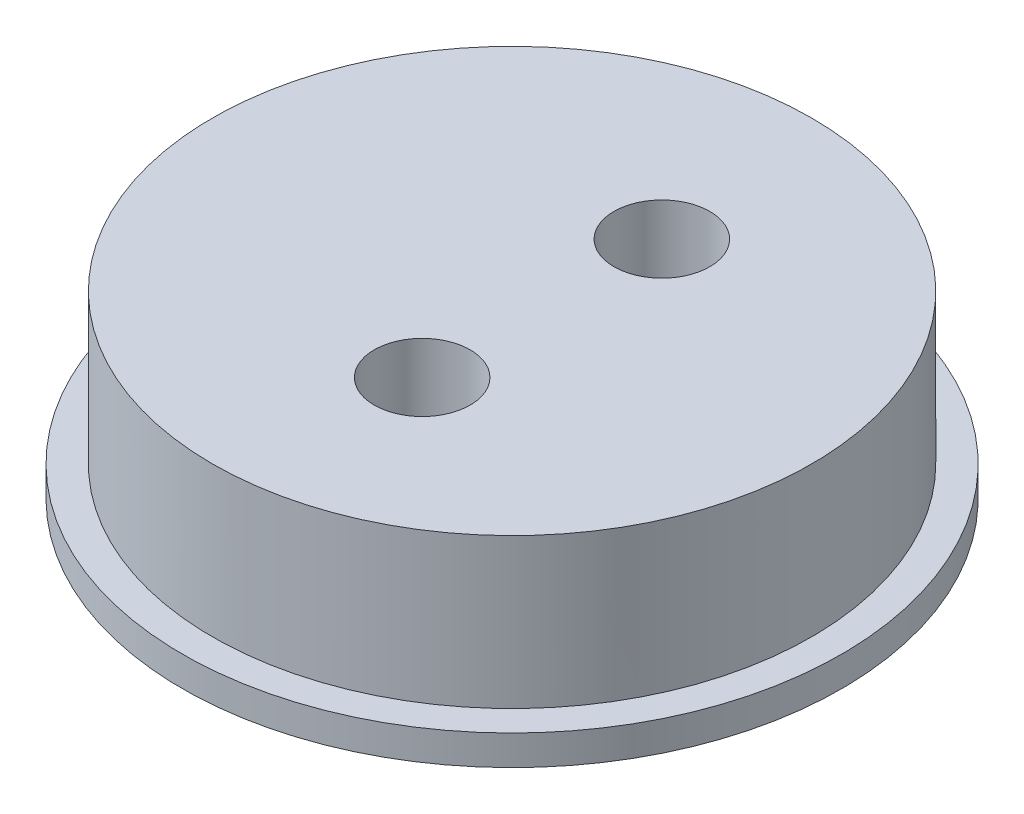
from build123d import *

# Parameters (mm, degrees)
SKETCH1_R           = 10
BOSS_EXTRUDE1_DEPTH = 6
SKETCH2_R           = 11
BOSS_EXTRUDE2_DEPTH = 1
SKETCH4_R           = 1.6
CUT_EXTRUDE1_DEPTH  = 18.349351573


with BuildPart() as part:
    # Sketch1 → Boss-Extrude1 (new body)
    with BuildSketch(Plane(origin=(0, 0, 0), x_dir=(1, 0, 0), z_dir=(0, 1, 0))):
        with Locations(Location((-1, 0, 0), (0, 0, 270))):
            Circle(SKETCH1_R)
    extrude(amount=BOSS_EXTRUDE1_DEPTH)

    # Sketch2 → Boss-Extrude2 (add)
    with BuildSketch(Plane.XZ):
        with Locations(Location((-1, 0, 0), (0, 0, 270))):
            Circle(SKETCH2_R)
    extrude(amount=-BOSS_EXTRUDE2_DEPTH)

    # Sketch4 → Cut-Extrude1 (cut, through all)
    with BuildSketch(Plane(origin=(0, 6, 0), x_dir=(1, 0, 0), z_dir=(0, 1, 0))):
        with Locations(Location((0, 4, 0), (0, 0, 270))):
            Circle(SKETCH4_R)
        with Locations(Location((0, -4, 0), (0, 0, 270))):
            Circle(SKETCH4_R)
    extrude(amount=-CUT_EXTRUDE1_DEPTH, mode=Mode.SUBTRACT)


solid = part.part
